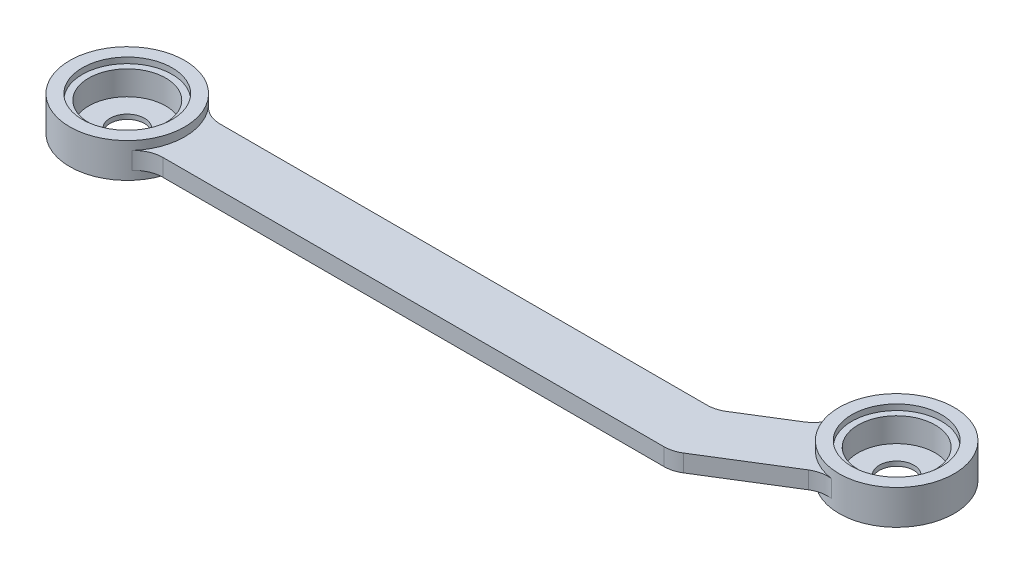
from build123d import *
from build123d.topology import SkipClean

# Parameters (mm, degrees)
SKETCH1_R           = 7.8
SKETCH1_R_2         = 3
BOSS_EXTRUDE2_DEPTH = 3
SKETCH2_R           = 7.8
CUT_EXTRUDE1_DEPTH  = 1
SKETCH3_R           = 6.7
CUT_EXTRUDE2_DEPTH  = 5.2
CUT_EXTRUDE4_DEPTH  = 1.5
CUT_EXTRUDE5_START  = -1.5
CUT_EXTRUDE5_DEPTH  = 1.5


with BuildPart() as part:
    # Sketch1 → Boss-Extrude2 (new, symmetric)
    # profile 1 of 3: a face of its own
    with BuildSketch(Plane(origin=(0, 0, 0), x_dir=(1, 0, 0), z_dir=(0, 1, 0))):
        with BuildLine():
            ThreePointArc((7.453559925, 6.666666667), (9.139098435, 5.435645354), (11.180339887, 5))
            Line((11.180339887, 5), (95.787507262, 5))
            ThreePointArc((95.787507262, 5), (97.157669446, 5.191397751), (98.422933246, 5.750937765))
            Line((98.422933246, 5.750937765), (106.744136599, 10.912056694))
            ThreePointArc((106.744136599, 10.912056694), (108.435692963, 12.655680094), (109.105807076, 14.990745953))
            ThreePointArc((109.105807076, 14.990745953), (126.766700664, 21.070412832), (117.680813085, 4.751216817))
            ThreePointArc((117.680813085, 4.751216817), (115.946610906, 4.695717028), (114.335793643, 4.050887461))
            Line((114.335793643, 4.050887461), (100.953895224, -4.249062235))
            ThreePointArc((100.953895224, -4.249062235), (99.688631423, -4.808602249), (98.318469239, -5))
            Line((98.318469239, -5), (11.180339887, -5))
            ThreePointArc((11.180339887, -5), (9.139098435, -5.435645354), (7.453559925, -6.666666667))
            ThreePointArc((7.453559925, -6.666666667), (-10, 0), (7.453559925, 6.666666667))
        make_face()
        with Locations((119.1, 14.65)):
            Circle(SKETCH1_R, mode=Mode.SUBTRACT)
        Circle(SKETCH1_R, mode=Mode.SUBTRACT)
    # profile 2 of 3: a face of its own
    with BuildSketch(Plane(origin=(0, 0, 0), x_dir=(1, 0, 0), z_dir=(0, 1, 0))):
        Circle(SKETCH1_R)
        with Locations(Location((0, 0, 0), (0, 0, 270))):
            Circle(SKETCH1_R_2, mode=Mode.SUBTRACT)
    # profile 3 of 3: a face of its own
    with BuildSketch(Plane(origin=(0, 0, 0), x_dir=(1, 0, 0), z_dir=(0, 1, 0))):
        with Locations((119.1, 14.65)):
            Circle(SKETCH1_R)
        with Locations(Location((119.1, 14.65, 0), (0, 0, 270))):
            Circle(SKETCH1_R_2, mode=Mode.SUBTRACT)
    extrude(amount=BOSS_EXTRUDE2_DEPTH, both=True)

    # Sketch2 → Cut-Extrude1 (cut)
    with BuildSketch(Plane(origin=(0, 3, 0), x_dir=(1, 0, 0), z_dir=(0, 1, 0))):
        with Locations(Location((119.1, 14.65, 0), (0, 0, 270))):
            Circle(SKETCH2_R)
        with Locations(Location((0, 0, 0), (0, 0, 270))):
            Circle(SKETCH2_R)
    extrude(amount=-CUT_EXTRUDE1_DEPTH, mode=Mode.SUBTRACT)

    # Sketch3 → Cut-Extrude2 (cut)
    with BuildSketch(Plane(origin=(0, 3, 0), x_dir=(1, 0, 0), z_dir=(0, 1, 0))):
        with Locations(Location((0, 0, 0), (0, 0, 270))):
            Circle(SKETCH3_R)
        with Locations(Location((119.1, 14.65, 0), (0, 0, 270))):
            Circle(SKETCH3_R)
    extrude(amount=-CUT_EXTRUDE2_DEPTH, mode=Mode.SUBTRACT)

    # Sketch4 → Cut-Extrude4 (cut)
    with BuildSketch(Plane(origin=(0, 3, 0), x_dir=(1, 0, 0), z_dir=(0, 1, 0))):
        with BuildLine():
            Line((106.744136599, 10.912056694), (98.422933246, 5.750937765))
            ThreePointArc((98.422933246, 5.750937765), (97.157669446, 5.191397751), (95.787507262, 5))
            Line((95.787507262, 5), (11.180339887, 5))
            ThreePointArc((11.180339887, 5), (9.139098435, 5.435645354), (7.453559925, 6.666666667))
            ThreePointArc((7.453559925, 6.666666667), (9.34172359, 3.568220898), (10, 0))
            ThreePointArc((10, 0), (9.34172359, -3.568220898), (7.453559925, -6.666666667))
            ThreePointArc((7.453559925, -6.666666667), (9.139098435, -5.435645354), (11.180339887, -5))
            Line((11.180339887, -5), (98.318469239, -5))
            ThreePointArc((98.318469239, -5), (99.688631423, -4.808602249), (100.953895224, -4.249062235))
            Line((100.953895224, -4.249062235), (114.335793643, 4.050887461))
            ThreePointArc((114.335793643, 4.050887461), (115.946610906, 4.695717028), (117.680813085, 4.751216817))
            ThreePointArc((117.680813085, 4.751216817), (111.433299336, 8.229587168), (109.105807076, 14.990745953))
            ThreePointArc((109.105807076, 14.990745953), (108.435692963, 12.655680094), (106.744136599, 10.912056694))
        make_face()
    extrude(amount=-CUT_EXTRUDE4_DEPTH, mode=Mode.SUBTRACT)

    # Sketch5 → Cut-Extrude5 (cut)
    with SkipClean():  # the faces are left unmerged after this step: merging them gives an invalid solid
        with BuildSketch(Plane.XZ.offset(3).offset(CUT_EXTRUDE5_START)):
            with BuildLine():
                ThreePointArc((7.453559925, 6.666666667), (9.34172359, 3.568220898), (10, 0))
                ThreePointArc((10, 0), (9.34172359, -3.568220898), (7.453559925, -6.666666667))
                ThreePointArc((7.453559925, -6.666666667), (9.139098435, -5.435645354), (11.180339887, -5))
                Line((11.180339887, -5), (95.787507262, -5))
                ThreePointArc((95.787507262, -5), (97.157669446, -5.191397751), (98.422933246, -5.750937765))
                Line((98.422933246, -5.750937765), (106.744136599, -10.912056694))
                ThreePointArc((106.744136599, -10.912056694), (108.435692963, -12.655680094), (109.105807076, -14.990745953))
                ThreePointArc((109.105807076, -14.990745953), (111.433299336, -8.229587168), (117.680813085, -4.751216817))
                ThreePointArc((117.680813085, -4.751216817), (115.946610906, -4.695717028), (114.335793643, -4.050887461))
                Line((114.335793643, -4.050887461), (100.953895224, 4.249062235))
                ThreePointArc((100.953895224, 4.249062235), (99.688631423, 4.808602249), (98.318469239, 5))
                Line((98.318469239, 5), (11.180339887, 5))
                ThreePointArc((11.180339887, 5), (9.139098435, 5.435645354), (7.453559925, 6.666666667))
            make_face()
        extrude(amount=CUT_EXTRUDE5_DEPTH, mode=Mode.SUBTRACT)


solid = part.part
